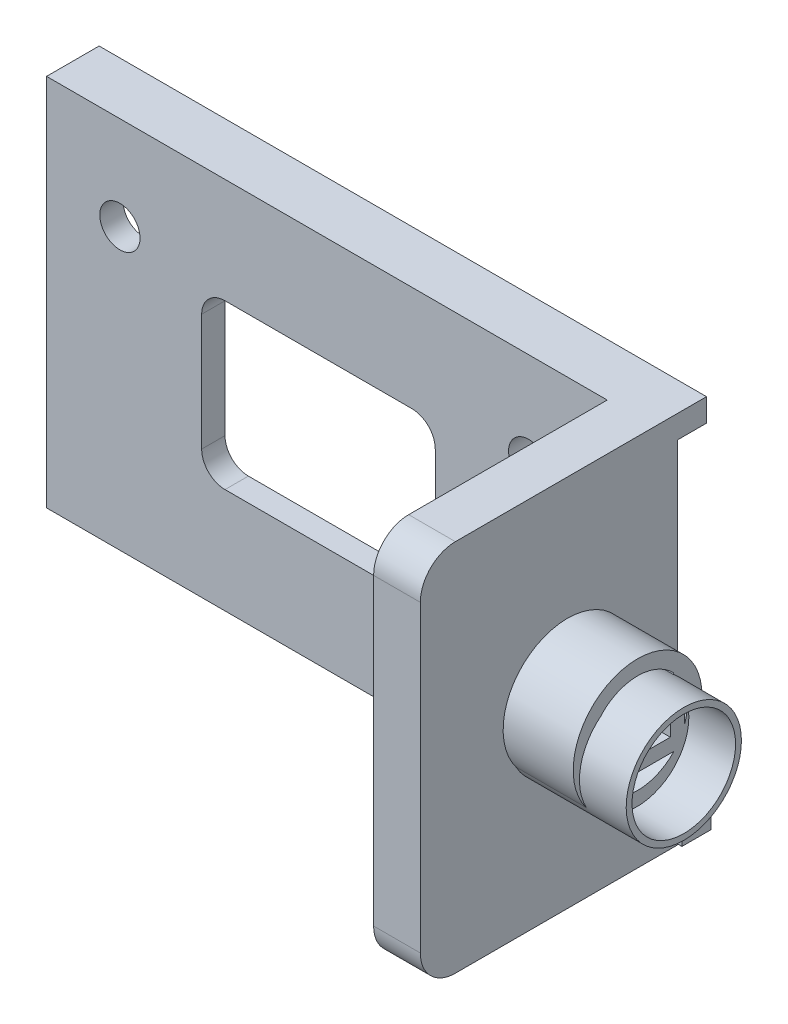
from build123d import *

# Parameters (mm, degrees)
SKETCH1_W           = 52
SKETCH1_H           = 32
BOSS_EXTRUDE1_DEPTH = 2
SKETCH2_W           = 4
SKETCH2_H           = 32
BOSS_EXTRUDE2_DEPTH = 20
FILLET1_R           = 3
SKETCH4_R           = 1.725
CUT_EXTRUDE2_DEPTH  = 2
SKETCH5_W           = 52.395546188
SKETCH5_H           = 2
BOSS_EXTRUDE3_DEPTH = 2.5
SKETCH6_W           = 20
SKETCH6_H           = 14
CUT_EXTRUDE3_DEPTH  = 2
SKETCH7_W           = 8.2
SKETCH7_H           = 5.8
SKETCH7_W_2         = 5.8
SKETCH7_H_2         = 3.4
BOSS_EXTRUDE4_DEPTH = 6
SKETCH10_R          = 4.93317494
SKETCH10_R_2        = 4.432714725
BOSS_EXTRUDE6_DEPTH = 10
SKETCH8_R           = 5.516570522
SKETCH8_R_2         = 4.25
BOSS_EXTRUDE5_DEPTH = 6
FILLET2_R           = 2


with BuildPart() as part:
    # Sketch1 → Boss-Extrude1 (new body)
    with BuildSketch(Plane.XY):
        with Locations((26, -16)):
            Rectangle(SKETCH1_W, SKETCH1_H)
    extrude(amount=BOSS_EXTRUDE1_DEPTH)

    # Sketch2 → Boss-Extrude2 (add)
    with BuildSketch(Plane(origin=(0, 0, 2), x_dir=(-1, 0, 0), z_dir=(0, 0, -1))):
        with Locations((-50, -16)):
            Rectangle(SKETCH2_W, SKETCH2_H)
    extrude(amount=-BOSS_EXTRUDE2_DEPTH)

    # Fillet1
    fillet1_edges = [part.edges().sort_by_distance(p)[0] for p in [
        (50, -32, 22),
        (50, 0, 22),
    ]]
    fillet(fillet1_edges, radius=FILLET1_R)

    # Sketch4 → Cut-Extrude2 (cut)
    with BuildSketch(Plane.XY.offset(2)):
        with Locations((41.277695867, -8)):
            Circle(SKETCH4_R)
        with Locations((6.277695867, -8)):
            Circle(SKETCH4_R)
    extrude(amount=-CUT_EXTRUDE2_DEPTH, mode=Mode.SUBTRACT)

    # Sketch5 → Boss-Extrude3 (add)
    with BuildSketch(Plane(origin=(0, 0, 0), x_dir=(-1, 0, 0), z_dir=(0, 0, -1))):
        with Locations((-26.197773094, -30.904147889)):
            Rectangle(SKETCH5_W, SKETCH5_H)
        Polygon((-52, -1.965960074), (0, -2.193486325), (0, 0), (-52, 0), align=None)
    extrude(amount=BOSS_EXTRUDE3_DEPTH)

    # Sketch6 → Cut-Extrude3 (cut)
    with BuildSketch(Plane.XY.offset(2)):
        with Locations((23.277695867, -16)):
            Rectangle(SKETCH6_W, SKETCH6_H)
    extrude(amount=-CUT_EXTRUDE3_DEPTH, mode=Mode.SUBTRACT)

    # Sketch7 → Boss-Extrude4 (add)
    with BuildSketch(Plane(origin=(52, 0, 0), x_dir=(0, 0, -1), z_dir=(1, 0, 0))):
        with Locations((-9.5, -16)):
            Rectangle(SKETCH7_W, SKETCH7_H)
        with Locations((-9.5, -16)):
            Rectangle(SKETCH7_W_2, SKETCH7_H_2, mode=Mode.SUBTRACT)
    extrude(amount=BOSS_EXTRUDE4_DEPTH)

    # Sketch10 → Boss-Extrude6 (add)
    with BuildSketch(Plane(origin=(52, 0, 0), x_dir=(0, 0, -1), z_dir=(1, 0, 0))):
        with Locations(Location((-9.443010808, -16.994711926, 0), (0, 0, 147.422084195))):
            Circle(SKETCH10_R)
        with Locations(Location((-9.443010808, -16.994711926, 0), (0, 0, 159.684920178))):
            Circle(SKETCH10_R_2, mode=Mode.SUBTRACT)
    extrude(amount=BOSS_EXTRUDE6_DEPTH)

    # Sketch8 → Boss-Extrude5 (add)
    with BuildSketch(Plane(origin=(52, 0, 0), x_dir=(0, 0, -1), z_dir=(1, 0, 0))):
        with Locations((-9.395508103, -16)):
            Circle(SKETCH8_R)
        with Locations((-9.395508103, -16)):
            Circle(SKETCH8_R_2, mode=Mode.SUBTRACT)
    extrude(amount=BOSS_EXTRUDE5_DEPTH)

    # Fillet2
    fillet2_edges = [part.edges().sort_by_distance(p)[0] for p in [
        (33.277695867, -9, 1),
        (33.277695867, -23, 1),
        (13.277695867, -23, 1),
        (13.277695867, -9, 1),
    ]]
    fillet(fillet2_edges, radius=FILLET2_R)


solid = part.part
